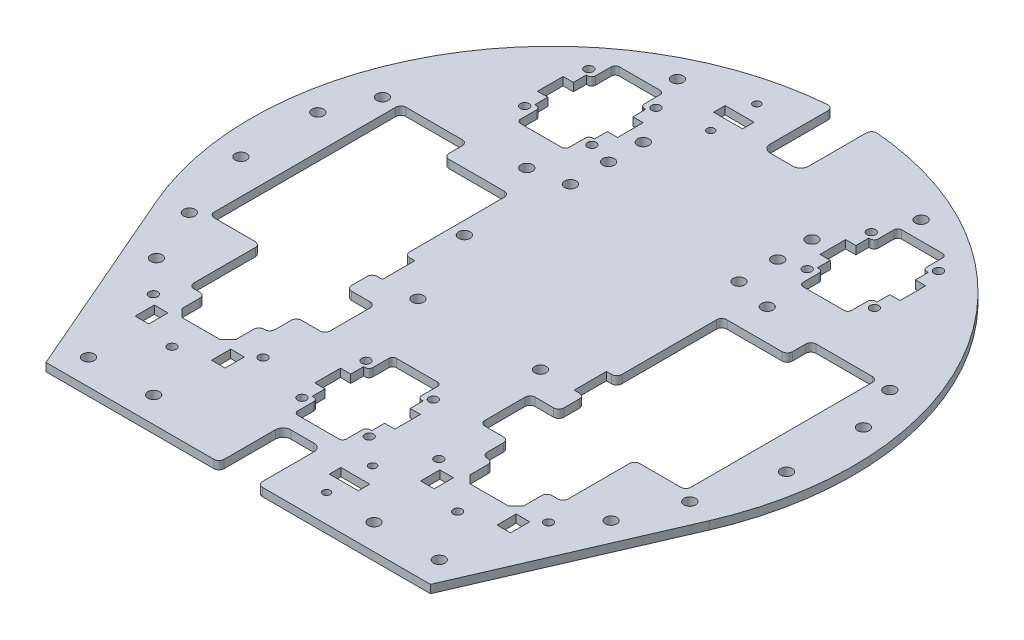
from build123d import *

# Parameters (mm, degrees)
SKETCH1_R                  = 117.5
BOSS_EXTRUDE1_DEPTH        = 3.175
BOSS_EXTRUDE2_DEPTH        = 3.175
CUT_EXTRUDE1_DEPTH         = 170.772143254
M3_CLEARANCE_HOLE1_D       = 3.4
SKETCH12_W                 = 19
SKETCH12_H                 = 38.4818793
CUT_EXTRUDE3_DEPTH         = 170.772143254
SKETCH14_W                 = 23.225
SKETCH14_H                 = 20.078784028
CUT_EXTRUDE4_DEPTH         = 170.772143254
SKETCH15_W                 = 31.225
SKETCH15_H                 = 10
CUT_EXTRUDE5_DEPTH         = 170.772143254
CUT_EXTRUDE6_DEPTH         = 170.772143254
FILLET1_R                  = 2
F_8_CLEARANCE_HOLE1_D      = 4.4958
M3_CLEARANCE_HOLE2_D       = 3.4
CUT_EXTRUDE8_DEPTH         = 170.772143254
FILLET4_R                  = 1.5
SKETCH29_W                 = 6
SKETCH29_H                 = 12.606716912
SKETCH29_W_2               = 13.2
SKETCH29_H_2               = 19.609721224
CUT_EXTRUDE9_DEPTH         = 170.772143254
FILLET5_R                  = 2
FILLET6_R                  = 2
SKETCH30_W                 = 5.3
SKETCH30_H                 = 7.484375372
CUT_EXTRUDE10_DEPTH        = 170.772143254
M2_5_CLEARANCE_HOLE1_D     = 2.9
M2_5_CLEARANCE_HOLE1_DEPTH = 3.18
M2_5_CLEARANCE_HOLE1_TIP   = 0.871247898
SKETCH33_W                 = 11.2796
SKETCH33_H                 = 4.5
CUT_EXTRUDE11_DEPTH        = 170.772143254


with BuildPart() as part:
    # Sketch1 → Boss-Extrude1 (new body)
    with BuildSketch(Plane(origin=(0, 0, 0), x_dir=(1, 0, 0), z_dir=(0, 1, 0))):
        with Locations(Location((0, 0, 0), (0, 0, 270))):
            Circle(SKETCH1_R)
    extrude(amount=BOSS_EXTRUDE1_DEPTH)

    # Sketch3 → Boss-Extrude2 (add)
    with BuildSketch(Plane(origin=(0, 0, 0), x_dir=(1, 0, 0), z_dir=(0, 1, 0))):
        Polygon((-107.826120738, -46.688089344), (-75, -122.5), (75, -122.5), (107.826120738, -46.688089344), align=None)
    extrude(amount=BOSS_EXTRUDE2_DEPTH)

    # Sketch4 → Cut-Extrude1 (cut, through all)
    with BuildSketch(Plane(origin=(0, 3.175, 0), x_dir=(1, 0, 0), z_dir=(0, 1, 0))):
        Polygon((93, 33.956195586), (67, 33.956195586), (67, 24.740509343), (41.4, 24.740509343), (41.4, -68.774716541), (73, -68.774716541), (73, -40.852885228), (93, -40.852885228), align=None)
        Polygon((-93, -40.852885228), (-93, 33.956195586), (-67, 33.956195586), (-67, 24.740509343), (-41.4, 24.740509343), (-41.4, -68.774716541), (-73, -68.774716541), (-73, -40.852885228), align=None)
    extrude(amount=-CUT_EXTRUDE1_DEPTH, mode=Mode.SUBTRACT)

    # M3 Clearance Hole1 (through all)
    with Locations(Plane(origin=(0, 3.175, 0), x_dir=(1, 0, 0), z_dir=(0, 1, 0))):
        with Locations((-68.225, 82.5), (-68.225, 57.5), (-42, 57.5), (-42, 82.5), (42, 82.5), (68.225, 82.5), (68.225, 57.5), (42, 57.5), (-13.1125, -59.5), (13.1125, -59.5), (13.1125, -84.5), (-13.1125, -84.5)):
            Hole(M3_CLEARANCE_HOLE1_D / 2)

    # Sketch12 → Cut-Extrude3 (cut, through all)
    with BuildSketch(Plane(origin=(0, 3.175, 0), x_dir=(1, 0, 0), z_dir=(0, 1, 0))):
        with Locations((-55.1125, 70)):
            Rectangle(SKETCH12_W, SKETCH12_H)
        with Locations((55.1125, 70)):
            Rectangle(SKETCH12_W, SKETCH12_H)
        with Locations((0, -72)):
            Rectangle(SKETCH12_W, SKETCH12_H)
    extrude(amount=-CUT_EXTRUDE3_DEPTH, mode=Mode.SUBTRACT)

    # Sketch14 → Cut-Extrude4 (cut, through all)
    with BuildSketch(Plane(origin=(0, 3.175, 0), x_dir=(1, 0, 0), z_dir=(0, 1, 0))):
        with Locations((-55.1125, 70)):
            Rectangle(SKETCH14_W, SKETCH14_H)
        with Locations((55.1125, 70)):
            Rectangle(SKETCH14_W, SKETCH14_H)
        with Locations((0, -72)):
            Rectangle(SKETCH14_W, SKETCH14_H)
    extrude(amount=-CUT_EXTRUDE4_DEPTH, mode=Mode.SUBTRACT)

    # Sketch15 → Cut-Extrude5 (cut, through all)
    with BuildSketch(Plane(origin=(0, 3.175, 0), x_dir=(1, 0, 0), z_dir=(0, 1, 0))):
        with Locations((-55.1125, 70)):
            Rectangle(SKETCH15_W, SKETCH15_H)
        with Locations((55.1125, 70)):
            Rectangle(SKETCH15_W, SKETCH15_H)
        with Locations((0, -72)):
            Rectangle(SKETCH15_W, SKETCH15_H)
    extrude(amount=-CUT_EXTRUDE5_DEPTH, mode=Mode.SUBTRACT)

    # Sketch16 → Cut-Extrude6 (cut, through all)
    with BuildSketch(Plane.XZ):
        with BuildLine():
            Line((-7.5, 122.5), (-7.5, 100.5))
            ThreePointArc((-7.5, 100.5), (-6.621320344, 98.378679656), (-4.5, 97.5))
            Line((-4.5, 97.5), (4.5, 97.5))
            ThreePointArc((4.5, 97.5), (6.621320344, 98.378679656), (7.5, 100.5))
            Line((7.5, 100.5), (7.5, 122.5))
            Line((7.5, 122.5), (-7.5, 122.5))
        make_face()
        with BuildLine():
            Line((-7.5, -117.260393996), (-7.5, -92.5))
            ThreePointArc((-7.5, -92.5), (-6.621320344, -90.378679656), (-4.5, -89.5))
            Line((-4.5, -89.5), (4.5, -89.5))
            ThreePointArc((4.5, -89.5), (6.621320344, -90.378679656), (7.5, -92.5))
            Line((7.5, -92.5), (7.5, -117.260393996))
            ThreePointArc((7.5, -117.260393996), (0, -117.5), (-7.5, -117.260393996))
        make_face()
    extrude(amount=-CUT_EXTRUDE6_DEPTH, mode=Mode.SUBTRACT)

    # Fillet1
    fillet1_edges = [part.edges().sort_by_distance(p)[0] for p in [
        (-7.5, 1.5875, 122.5),
        (7.5, 1.5875, 122.5),
        (7.5, 1.5875, -117.260393996),
        (-7.5, 1.5875, -117.260393996),
    ]]
    fillet(fillet1_edges, radius=FILLET1_R)

    # #8 Clearance Hole1 (through all)
    with Locations(Plane.XZ):
        with Locations((-88.690160914, 65.715561379), (-106.44834428, 15), (-106.44834428, -15), (32.9, -68.45), (33, -55), (32.9, -40), (-32.9, -40), (-36.4, -2.131898237), (-33, -55), (-32.9, -68.45), (-47.536038885, -96.418748214), (47.536038885, -96.418748214), (106.44834428, -15), (106.44834428, 15), (88.690160914, 65.715561379), (43, 112.5), (-43, 112.5), (-68.432768408, 112.5), (68.432768408, 112.5), (-98.965052304, -32.771648149), (-46.9, -37), (-23.9, 28.462878702), (-97.638338636, 43.940203625), (23.9, 28.462878702), (46.9, -37), (98.965052304, -32.771648149), (97.638338636, 43.940203625)):
            Hole(F_8_CLEARANCE_HOLE1_D / 2)

    # M3 Clearance Hole2 (through all)
    with Locations(Plane(origin=(0, 0, 0), x_dir=(-1, 0, 0), z_dir=(0, -1, 0))):
        with Locations((77.1, -78.508716942), (-77.1, -78.508716942), (-55.7, -92.620686784), (-34.3, -78.508716942), (34.3, -78.508716942), (55.7, -92.620686784)):
            Hole(M3_CLEARANCE_HOLE2_D / 2)

    # Sketch22 → Cut-Extrude8 (cut, through all)
    with BuildSketch(Plane.XZ):
        Polygon((45.7, 66.774716541), (45.7, 77.817656481), (48.7, 80.817656481), (63.7, 80.817656481), (66.7, 77.817656481), (66.7, 66.774716541), align=None)
        Polygon((-45.7, 66.774716541), (-66.7, 66.774716541), (-66.7, 77.817656481), (-63.7, 80.817656481), (-48.7, 80.817656481), (-45.7, 77.817656481), align=None)
    extrude(amount=-CUT_EXTRUDE8_DEPTH, mode=Mode.SUBTRACT)

    # Fillet4
    fillet4_edges = [part.edges().sort_by_distance(p)[0] for p in [
        (-64.6125, 1.5875, -50.75906035),
        (-64.6125, 1.5875, -89.24093965),
        (-45.6125, 1.5875, -89.24093965),
        (-45.6125, 1.5875, -50.75906035),
        (45.6125, 1.5875, -50.75906035),
        (45.6125, 1.5875, -89.24093965),
        (64.6125, 1.5875, -89.24093965),
        (64.6125, 1.5875, -50.75906035),
        (-9.5, 1.5875, 91.24093965),
        (-9.5, 1.5875, 52.75906035),
        (9.5, 1.5875, 52.75906035),
        (9.5, 1.5875, 91.24093965),
        (-45.6125, 1.5875, -59.960607986),
        (-45.6125, 1.5875, -80.039392014),
        (64.6125, 1.5875, -59.960607986),
        (64.6125, 1.5875, -80.039392014),
        (9.5, 1.5875, 82.039392014),
        (9.5, 1.5875, 61.960607986),
        (-64.6125, 1.5875, -80.039392014),
        (-64.6125, 1.5875, -59.960607986),
        (45.6125, 1.5875, -80.039392014),
        (45.6125, 1.5875, -59.960607986),
        (-9.5, 1.5875, 61.960607986),
        (-9.5, 1.5875, 82.039392014),
    ]]
    fillet(fillet4_edges, radius=FILLET4_R)

    # Sketch29 → Cut-Extrude9 (cut, through all)
    with BuildSketch(Plane(origin=(0, 3.175, 0), x_dir=(1, 0, 0), z_dir=(0, 1, 0))):
        with Locations((40.4, -22.520541121)):
            Rectangle(SKETCH29_W, SKETCH29_H)
        with Locations((-40.4, -22.520541121)):
            Rectangle(SKETCH29_W, SKETCH29_H)
        with Locations((36.8, -48.620599087)):
            Rectangle(SKETCH29_W_2, SKETCH29_H_2)
        with Locations((-36.8, -48.620599087)):
            Rectangle(SKETCH29_W_2, SKETCH29_H_2)
    extrude(amount=-CUT_EXTRUDE9_DEPTH, mode=Mode.SUBTRACT)

    # Fillet5
    fillet5_edges = [part.edges().sort_by_distance(p)[0] for p in [
        (93, 1.5875, -33.956195586),
        (93, 1.5875, 40.852885228),
        (73, 1.5875, 40.852885228),
        (73, 1.5875, 68.774716541),
        (41.4, 1.5875, 68.774716541),
        (41.4, 1.5875, -24.740509343),
        (67, 1.5875, -24.740509343),
        (67, 1.5875, -33.956195586),
        (45.7, 1.5875, 68.774716541),
        (66.7, 1.5875, 68.774716541),
        (41.4, 1.5875, 28.823899577),
        (41.4, 1.5875, 16.217182665),
        (41.4, 1.5875, 58.425459699),
        (41.4, 1.5875, 38.815738475),
        (30.2, 1.5875, 38.815738475),
        (30.2, 1.5875, 58.425459699),
    ]]
    fillet(fillet5_edges, radius=FILLET5_R)

    # Fillet6
    fillet6_edges = [part.edges().sort_by_distance(p)[0] for p in [
        (-30.2, 1.5875, 58.425459699),
        (-30.2, 1.5875, 38.815738475),
        (-73, 1.5875, 40.852885228),
        (-93, 1.5875, 40.852885228),
        (-93, 1.5875, -33.956195586),
        (-67, 1.5875, -33.956195586),
        (-67, 1.5875, -24.740509343),
        (-41.4, 1.5875, -24.740509343),
        (-41.4, 1.5875, 68.774716541),
        (-73, 1.5875, 68.774716541),
        (-66.7, 1.5875, 68.774716541),
        (-45.7, 1.5875, 68.774716541),
        (-41.4, 1.5875, 58.425459699),
        (-41.4, 1.5875, 38.815738475),
        (-41.4, 1.5875, 28.823899577),
        (-41.4, 1.5875, 16.217182665),
    ]]
    fillet(fillet6_edges, radius=FILLET6_R)

    # Sketch30 → Cut-Extrude10 (cut, through all)
    with BuildSketch(Plane.XZ):
        with Locations((-70.6, 85.725468795)):
            Rectangle(SKETCH30_W, SKETCH30_H)
        with Locations((-40.8, 85.725468795)):
            Rectangle(SKETCH30_W, SKETCH30_H)
        with Locations((40.8, 85.725468795)):
            Rectangle(SKETCH30_W, SKETCH30_H)
        with Locations((70.6, 85.725468795)):
            Rectangle(SKETCH30_W, SKETCH30_H)
    extrude(amount=-CUT_EXTRUDE10_DEPTH, mode=Mode.SUBTRACT)

    # M2.5 Clearance Hole1
    with Locations(Plane(origin=(0, 3.175, 0), x_dir=(1, 0, 0), z_dir=(0, 1, 0))):
        with Locations((23.6602, -111.709103466), (23.6602, -93.710896534), (-23.6602, 85.530896534), (-23.6602, 103.529103466)):
            Hole(M2_5_CLEARANCE_HOLE1_D / 2, depth=M2_5_CLEARANCE_HOLE1_DEPTH)
            with Locations((0, 0, -(M2_5_CLEARANCE_HOLE1_DEPTH + M2_5_CLEARANCE_HOLE1_TIP / 2))):  # 118° drill point
                Cone(0, M2_5_CLEARANCE_HOLE1_D / 2, M2_5_CLEARANCE_HOLE1_TIP, mode=Mode.SUBTRACT)

    # Sketch33 → Cut-Extrude11 (cut, through all)
    with BuildSketch(Plane.XZ):
        with Locations((23.6602, 102.71)):
            Rectangle(SKETCH33_W, SKETCH33_H)
        with Locations((-23.6602, -94.53)):
            Rectangle(SKETCH33_W, SKETCH33_H)
    extrude(amount=-CUT_EXTRUDE11_DEPTH, mode=Mode.SUBTRACT)


solid = part.part
